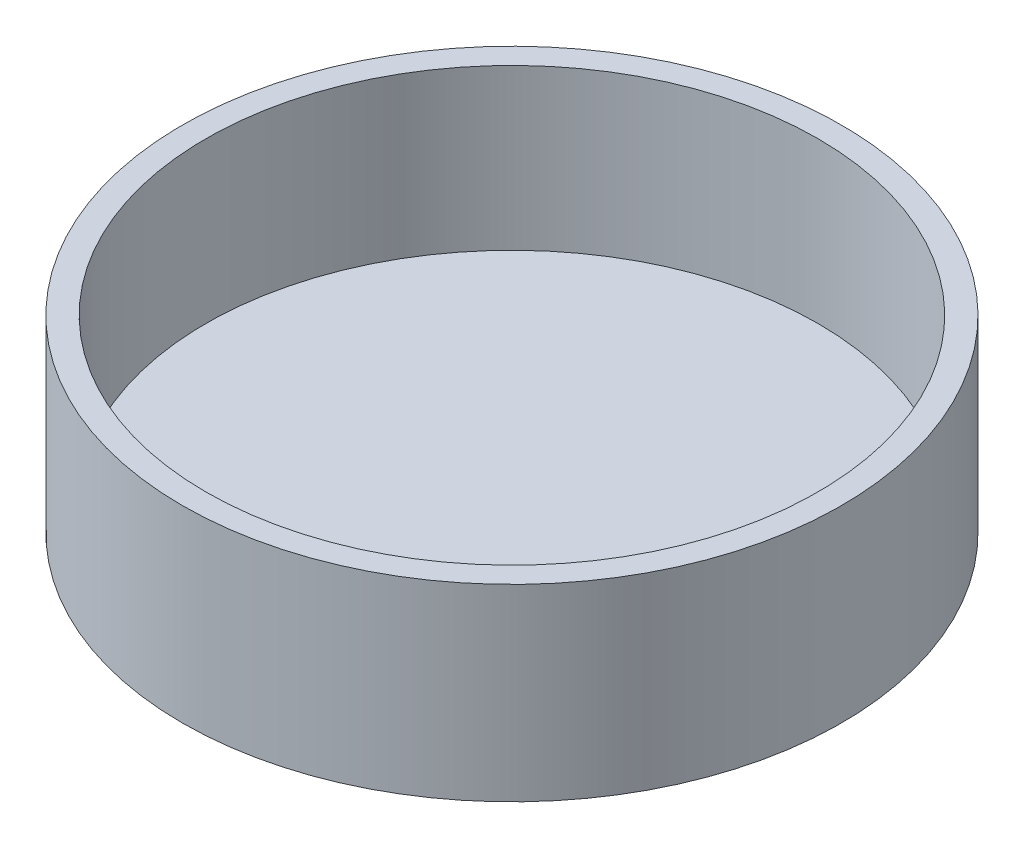
from build123d import *

# Parameters (mm, degrees)
SKETCH1_R           = 35
SKETCH1_R_2         = 32.5
BOSS_EXTRUDE1_DEPTH = 20
BOSS_EXTRUDE2_START = -3
SKETCH3_R           = 32.5
BOSS_EXTRUDE2_DEPTH = 3


with BuildPart() as part:
    # Sketch1 → Boss-Extrude1 (new body)
    with BuildSketch(Plane(origin=(0, 0, 0), x_dir=(1, 0, 0), z_dir=(0, 1, 0))):
        with Locations(Location((0, 0, 0), (0, 0, 270))):
            Circle(SKETCH1_R)
        with Locations(Location((0, 0, 0), (0, 0, 270))):
            Circle(SKETCH1_R_2, mode=Mode.SUBTRACT)
    extrude(amount=-BOSS_EXTRUDE1_DEPTH)

    # Sketch3 → Boss-Extrude2 (add)
    with BuildSketch(Plane.XZ.offset(20).offset(BOSS_EXTRUDE2_START)):
        with Locations(Location((0, 0, 0), (0, 0, 90))):
            Circle(SKETCH3_R)
    extrude(amount=BOSS_EXTRUDE2_DEPTH)


solid = part.part
